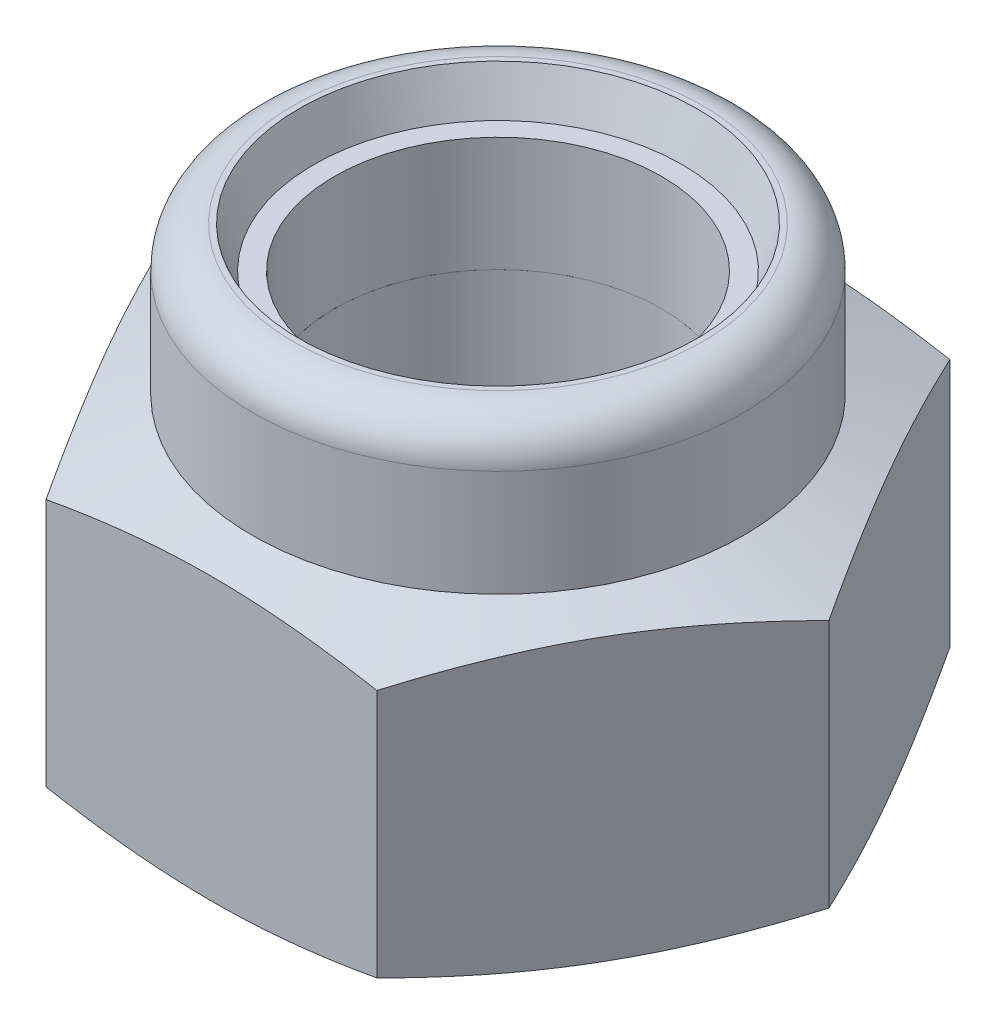
from build123d import *

# Parameters (mm, degrees)
SKETCH_2_R      = 2.5
EXTRUDE_1_DEPTH = 3.8
SKETCH_4_R      = 2.5
SKETCH_4_R_2    = 2
EXTRUDE_2_DEPTH = 1.4


with BuildPart() as part:
    # 草图1 → 旋转1 (revolve)
    with BuildSketch(Plane.XY, mode=Mode.PRIVATE) as revolve_1_sk:
        with BuildLine():
            Line((2, 3.7), (2, 0.173205081))
            Line((2, 0.173205081), (2.3, 0))
            Line((2.3, 0), (3, 0))
            Line((3, 0), (3, 5.1))
            ThreePointArc((3, 5.1), (2.853553391, 5.453553391), (2.5, 5.6))
            Line((2.5, 5.6), (2.431985117, 5.6))
            Line((2.431985117, 5.6), (2.25, 5.1))
            Line((2.25, 5.1), (2.5, 5.1))
            Line((2.5, 5.1), (2.5, 3.7))
            Line((2.5, 3.7), (2, 3.7))
        make_face()
    revolve(revolve_1_sk.sketch.rotate(Axis((0, -0.04163543, 0), (0, 1, 0)), 90), axis=Axis((0, -0.04163543, 0), (0, 1, 0)))

    # 草图2 → 凸台-拉伸1 (add)
    with BuildSketch(Plane(origin=(0, 0, 0), x_dir=(1, 0, 0), z_dir=(0, 1, 0))):
        Polygon((4.041451884, 0), (2.020725942, 3.5), (-2.020725942, 3.5), (-4.041451884, 0), (-2.020725942, -3.5), (2.020725942, -3.5), align=None)
        with Locations(Location((0, 0, 0), (0, 0, 90))):
            Circle(SKETCH_2_R, mode=Mode.SUBTRACT)
    extrude(amount=EXTRUDE_1_DEPTH)

    # 草图3 → 切除-旋转1 (revolve, cut)
    with BuildSketch(Plane.XY, mode=Mode.PRIVATE) as cut_revolve_1_sk:
        Polygon((-3, 3.8), (-4.041451884, 3.420942514), (-4.041451884, 3.8), align=None)
        Polygon((-3, 0), (-4.041451884, 0), (-4.041451884, 0.379057486), align=None)
    revolve(cut_revolve_1_sk.sketch.rotate(Axis((0, 0, 0), (0, 1, 0)), 60.000004143), axis=Axis((0, 0, 0), (0, 1, 0)), mode=Mode.SUBTRACT)


with BuildPart() as body_2:
    # 草图4 → 凸台-拉伸2 (new body)
    with BuildSketch(Plane(origin=(0, 3.7, 0), x_dir=(1, 0, 0), z_dir=(0, 1, 0))):
        with Locations(Location((0, 0, 0), (0, 0, 90))):
            Circle(SKETCH_4_R)
        with Locations(Location((0, 0, 0), (0, 0, 90))):
            Circle(SKETCH_4_R_2, mode=Mode.SUBTRACT)
    extrude(amount=EXTRUDE_2_DEPTH)


solid = Compound([part.part, body_2.part])
